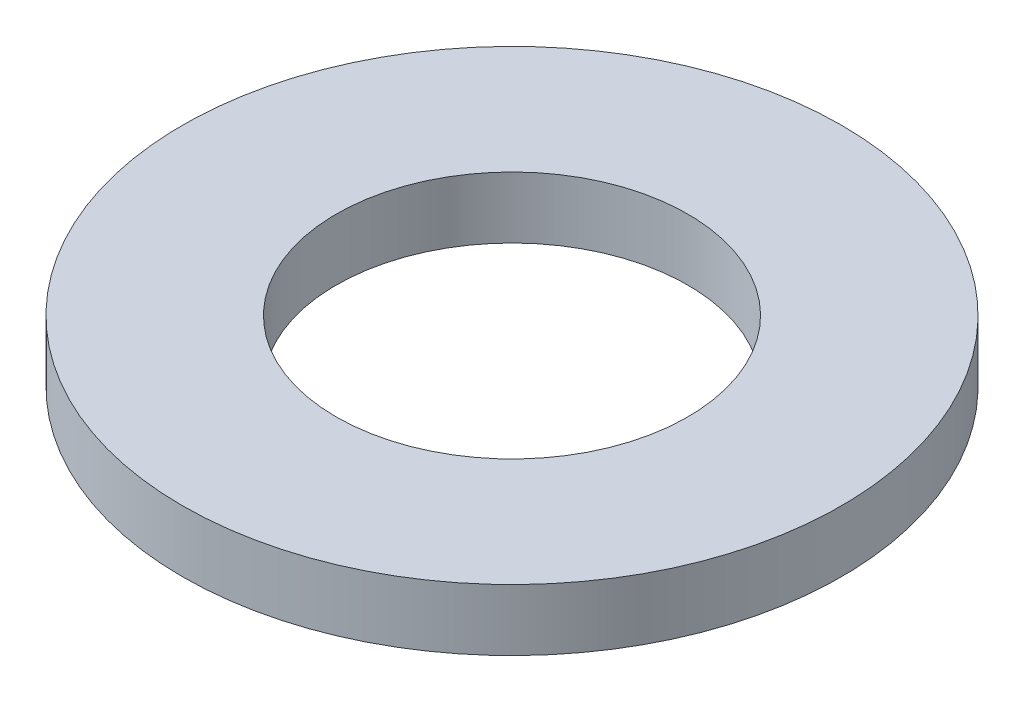
from build123d import *

# Parameters (mm, degrees)
SKETCH1_R           = 7.5
SKETCH1_R_2         = 4
BOSS_EXTRUDE1_DEPTH = 1.4


with BuildPart() as part:
    # Sketch1 → Boss-Extrude1 (new body)
    with BuildSketch(Plane(origin=(0, 0, 0), x_dir=(1, 0, 0), z_dir=(0, 1, 0))):
        with Locations(Location((0, 0, 0), (0, 0, 270))):
            Circle(SKETCH1_R)
        with Locations(Location((0, 0, 0), (0, 0, 270))):
            Circle(SKETCH1_R_2, mode=Mode.SUBTRACT)
    extrude(amount=BOSS_EXTRUDE1_DEPTH)


solid = part.part
